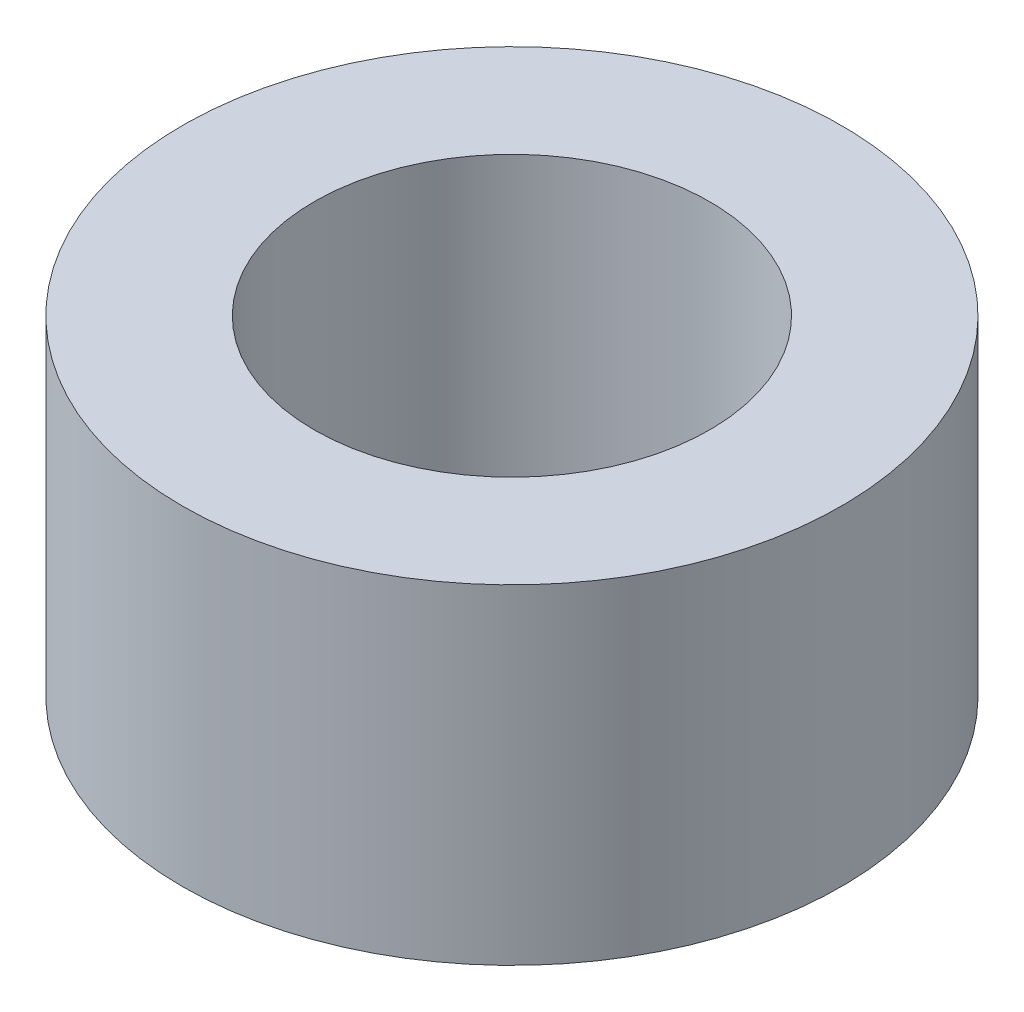
from build123d import *

# Parameters (mm, degrees)
SKETCH1_R           = 5
SKETCH1_R_2         = 3
BOSS_EXTRUDE1_DEPTH = 5


with BuildPart() as part:
    # Sketch1 → Boss-Extrude1 (new body)
    with BuildSketch(Plane(origin=(0, 0, 0), x_dir=(1, 0, 0), z_dir=(0, 1, 0))):
        with Locations(Location((0, 0, 0), (0, 0, 270))):
            Circle(SKETCH1_R)
        with Locations(Location((0, 0, 0), (0, 0, 270))):
            Circle(SKETCH1_R_2, mode=Mode.SUBTRACT)
    extrude(amount=BOSS_EXTRUDE1_DEPTH)


solid = part.part
